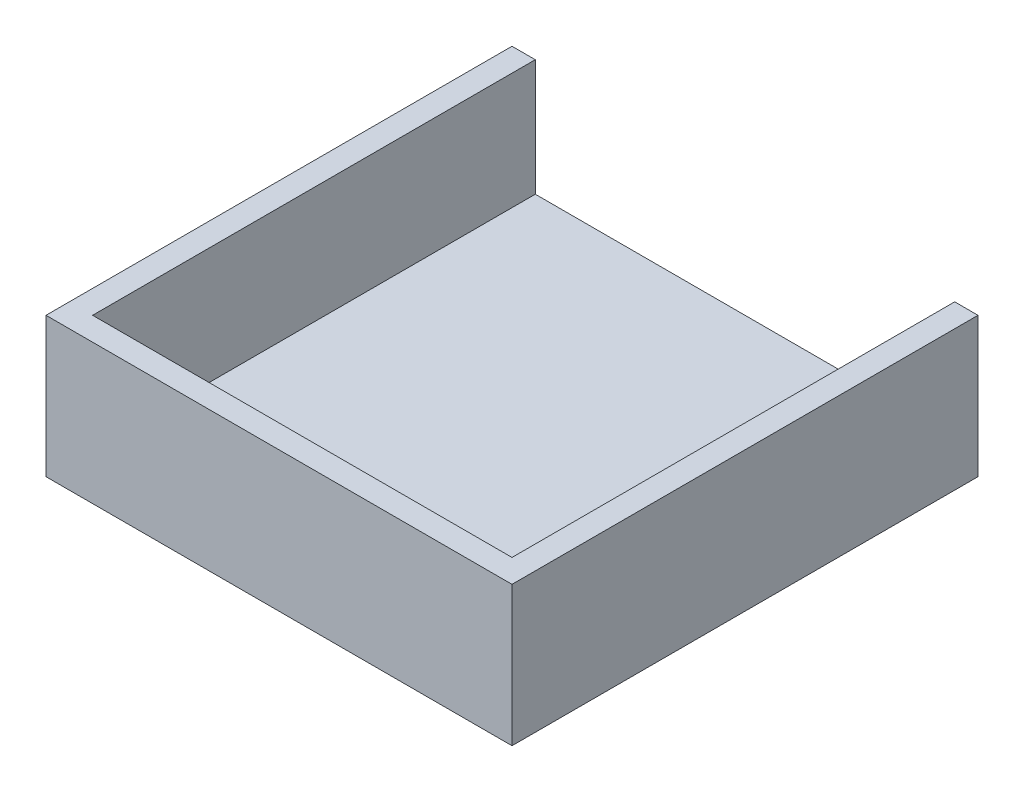
from build123d import *

# Parameters (mm, degrees)
SKETCH_1_W          = 20
SKETCH_1_H          = 20
EXTRUDE_1_DEPTH     = 6
CUT_EXTRUDE_START   = 1
SKETCH_3_W          = 18
SKETCH_3_H          = 19
CUT_EXTRUDE_1_DEPTH = 6
EXTRUDE_START       = 6
SKETCH_4_W          = 20
SKETCH_4_H          = 20
EXTRUDE_2_DEPTH     = 1
CUT_EXTRUDE_START_2 = 7
SKETCH_7_W          = 14
SKETCH_7_H          = 16
CUT_EXTRUDE_3_DEPTH = 1
SKETCH_8_W          = 20
SKETCH_8_H          = 20
CUT_EXTRUDE_4_DEPTH = 1


with BuildPart() as part:
    # 스케치1 → 보스-돌출1 (new body)
    with BuildSketch(Plane(origin=(0, 0, 0), x_dir=(1, 0, 0), z_dir=(0, 1, 0))):
        Rectangle(SKETCH_1_W, SKETCH_1_H)
    extrude(amount=EXTRUDE_1_DEPTH)

    # 스케치3 → 컷-돌출1 (cut)
    with BuildSketch(Plane(origin=(0, 0, 0), x_dir=(1, 0, 0), z_dir=(0, 1, 0)).offset(CUT_EXTRUDE_START)):
        with Locations((0, 0.5)):
            Rectangle(SKETCH_3_W, SKETCH_3_H)
    extrude(amount=CUT_EXTRUDE_1_DEPTH, mode=Mode.SUBTRACT)


with BuildPart() as body_2:
    # 스케치4 → 보스-돌출2 (new body)
    with BuildSketch(Plane(origin=(0, 0, 0), x_dir=(1, 0, 0), z_dir=(0, 1, 0)).offset(EXTRUDE_START)):
        Rectangle(SKETCH_4_W, SKETCH_4_H)
    extrude(amount=EXTRUDE_2_DEPTH)

    # 스케치7 → 컷-돌출3 (cut)
    with BuildSketch(Plane(origin=(0, 0, 0), x_dir=(1, 0, 0), z_dir=(0, 1, 0)).offset(CUT_EXTRUDE_START_2)):
        with Locations((0, -1)):
            Rectangle(SKETCH_7_W, SKETCH_7_H)
    extrude(amount=-CUT_EXTRUDE_3_DEPTH, mode=Mode.SUBTRACT)

    # 스케치8 → 컷-돌출4 (cut)
    with BuildSketch(Plane(origin=(0, 7, 0), x_dir=(1, 0, 0), z_dir=(0, 1, 0))):
        Rectangle(SKETCH_8_W, SKETCH_8_H)
    extrude(amount=-CUT_EXTRUDE_4_DEPTH, mode=Mode.SUBTRACT)


solid = part.part
